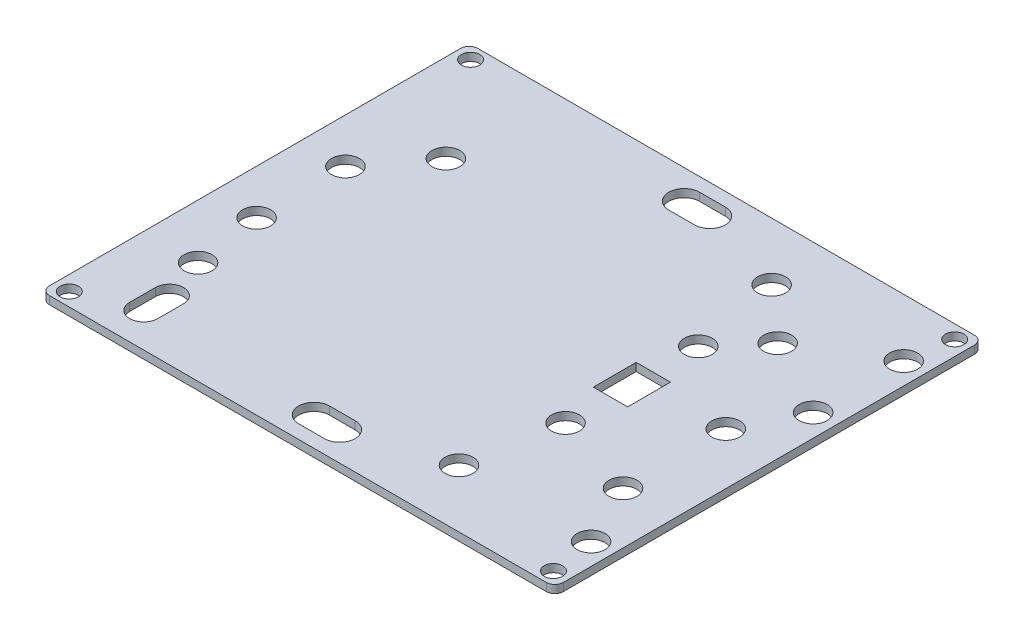
from build123d import *

# Parameters (mm, degrees)
SKETCH1_W               = 152.4
SKETCH1_H               = 127
BOSS_EXTRUDE1_DEPTH     = 2.3622
FILLET1_R               = 2.54
SKETCH9_R               = 4.15
CUT_EXTRUDE8_DEPTH      = 100.218294628
CUT_EXTRUDE11_DEPTH     = 100.218294628
CUT_EXTRUDE12_DEPTH     = 100.218294628
SKETCH16_R              = 4.15
CUT_EXTRUDE14_DEPTH     = 100.218294628
SKETCH17_R              = 2.7305
CUT_EXTRUDE16_DEPTH     = 100.218294628
MIRROR7_COPY_1_SKETCH_R = 2.7305
MIRROR7_COPY_1_DEPTH    = 100.218294628
SKETCH26_W              = 10.16
SKETCH26_H              = 12.7
CUT_EXTRUDE26_DEPTH     = 100.218294628
SKETCH27_R              = 4.15
CUT_EXTRUDE27_DEPTH     = 100.218294628
SKETCH29_R              = 4.15
CUT_EXTRUDE28_DEPTH     = 100.218294628
SKETCH30_R              = 4.15
CUT_EXTRUDE29_DEPTH     = 100.218294628
SKETCH31_R              = 4.15
CUT_EXTRUDE30_DEPTH     = 100.218294628


with BuildPart() as part:
    # Sketch1 → Boss-Extrude1 (new body)
    with BuildSketch(Plane(origin=(0, 0, 0), x_dir=(1, 0, 0), z_dir=(0, 1, 0))):
        Rectangle(SKETCH1_W, SKETCH1_H)
    extrude(amount=BOSS_EXTRUDE1_DEPTH)

    # Fillet1
    fillet1_edges = [part.edges().sort_by_distance(p)[0] for p in [
        (76.2, 1.1811, 63.5),
        (-76.2, 1.1811, 63.5),
        (-76.2, 1.1811, -63.5),
        (76.2, 1.1811, -63.5),
    ]]
    fillet(fillet1_edges, radius=FILLET1_R)

    # Sketch9 → Cut-Extrude8 (cut, through all)
    with BuildSketch(Plane.XZ):
        with Locations(Location((60.8584, 27.94, 0), (0, 0, 270))):
            Circle(SKETCH9_R)
        with Locations(Location((60.8584, -2.54, 0), (0, 0, 270))):
            Circle(SKETCH9_R)
    extrude(amount=-CUT_EXTRUDE8_DEPTH, mode=Mode.SUBTRACT)

    # Sketch12 → Cut-Extrude11 (cut, through all)
    with BuildSketch(Plane.XZ):
        with BuildLine():
            Line((-3.81, 59.465627528), (3.81, 59.465627528))
            ThreePointArc((3.81, 59.465627528), (8.387405636, 54.888221892), (3.81, 50.310816255))
            Line((3.81, 50.310816255), (-3.81, 50.310816255))
            ThreePointArc((-3.81, 50.310816255), (-8.387405636, 54.888221892), (-3.81, 59.465627528))
        make_face()
    cut_extrude11 = extrude(amount=-CUT_EXTRUDE11_DEPTH, mode=Mode.SUBTRACT)

    # Mirror3: Cut-Extrude11 across plane
    add(cut_extrude11.mirror(Plane.XY), mode=Mode.SUBTRACT)

    # Sketch13 → Cut-Extrude12 (cut, through all)
    with BuildSketch(Plane(origin=(0, 0, 0), x_dir=(-1, 0, 0), z_dir=(0, -1, 0))):
        with BuildLine():
            Line((60.052874771, -45.72), (60.052874771, -53.34))
            ThreePointArc((60.052874771, -53.34), (55.88, -57.512874771), (51.707125229, -53.34))
            Line((51.707125229, -53.34), (51.707125229, -45.72))
            ThreePointArc((51.707125229, -45.72), (55.88, -41.547125229), (60.052874771, -45.72))
        make_face()
    extrude(amount=-CUT_EXTRUDE12_DEPTH, mode=Mode.SUBTRACT)

    # Sketch16 → Cut-Extrude14 (cut, through all)
    with BuildSketch(Plane(origin=(0, 0, 0), x_dir=(-1, 0, 0), z_dir=(0, -1, 0))):
        with Locations(Location((-69.599893995, 19.704320306, 0), (0, 0, 90))):
            Circle(SKETCH16_R)
        with Locations(Location((-46.522565834, 32.264238523, 0), (0, 0, 90))):
            Circle(SKETCH16_R)
    extrude(amount=-CUT_EXTRUDE14_DEPTH, mode=Mode.SUBTRACT)

    # Sketch17 → Cut-Extrude16 (cut, through all)
    with BuildSketch(Plane.XZ):
        with Locations(Location((71.794813785, 59.510435834, 0), (0, 0, 270))):
            Circle(SKETCH17_R)
    cut_extrude16 = extrude(amount=-CUT_EXTRUDE16_DEPTH, mode=Mode.SUBTRACT)

    # Mirror6: Cut-Extrude16 across plane
    add(cut_extrude16.mirror(Plane(origin=(0, 0, 0), x_dir=(0, 0, 1), z_dir=(1, 0, 0))), mode=Mode.SUBTRACT)

    # Mirror7: Cut-Extrude16 across plane
    add(cut_extrude16.mirror(Plane.XY), mode=Mode.SUBTRACT)

    # Mirror7 copy 1 sketch → Mirror7 copy 1 (cut, through all)
    with BuildSketch(Plane(origin=(0, 0, 0), x_dir=(-1, 0, 0), z_dir=(0, -1, 0))):
        with Locations(Location((71.794813785, 59.510435834, 0), (0, 0, 270))):
            Circle(MIRROR7_COPY_1_SKETCH_R)
    extrude(amount=-MIRROR7_COPY_1_DEPTH, mode=Mode.SUBTRACT)

    # Sketch26 → Cut-Extrude26 (cut, through all)
    with BuildSketch(Plane(origin=(0, 2.3622, 0), x_dir=(1, 0, 0), z_dir=(0, 1, 0))):
        with Locations((35.56, 0)):
            Rectangle(SKETCH26_W, SKETCH26_H)
    extrude(amount=-CUT_EXTRUDE26_DEPTH, mode=Mode.SUBTRACT)

    # Sketch27 → Cut-Extrude27 (cut, through all)
    with BuildSketch(Plane.XZ):
        with Locations(Location((-60.09170874, 33.02, 0), (0, 0, 270))):
            Circle(SKETCH27_R)
        with Locations(Location((-50.09170874, -30.48, 0), (0, 0, 270))):
            Circle(SKETCH27_R)
    extrude(amount=-CUT_EXTRUDE27_DEPTH, mode=Mode.SUBTRACT)

    # Sketch29 → Cut-Extrude28 (cut, through all)
    with BuildSketch(Plane(origin=(0, 2.3622, 0), x_dir=(1, 0, 0), z_dir=(0, 1, 0))):
        with Locations(Location((35.56, 19.681240592, 0), (0, 0, 270))):
            Circle(SKETCH29_R)
        with Locations(Location((35.56, -19.681240592, 0), (0, 0, 270))):
            Circle(SKETCH29_R)
    extrude(amount=-CUT_EXTRUDE28_DEPTH, mode=Mode.SUBTRACT)

    # Sketch30 → Cut-Extrude29 (cut, through all)
    with BuildSketch(Plane(origin=(0, 2.3622, 0), x_dir=(1, 0, 0), z_dir=(0, 1, 0))):
        with Locations(Location((69.803274088, -46.355, 0), (0, 0, 270))):
            Circle(SKETCH30_R)
        with Locations(Location((30.63517528, -46.355, 0), (0, 0, 270))):
            Circle(SKETCH30_R)
    cut_extrude29 = extrude(amount=-CUT_EXTRUDE29_DEPTH, mode=Mode.SUBTRACT)

    # Mirror8: Cut-Extrude29 across plane
    add(cut_extrude29.mirror(Plane.XY), mode=Mode.SUBTRACT)

    # Sketch31 → Cut-Extrude30 (cut, through all)
    with BuildSketch(Plane(origin=(0, 2.3622, 0), x_dir=(1, 0, 0), z_dir=(0, 1, 0))):
        with Locations(Location((-62.942335235, -12.79551579, 0), (0, 0, 270))):
            Circle(SKETCH31_R)
        with Locations(Location((-62.942335235, 13.549600091, 0), (0, 0, 270))):
            Circle(SKETCH31_R)
    extrude(amount=-CUT_EXTRUDE30_DEPTH, mode=Mode.SUBTRACT)


solid = part.part
